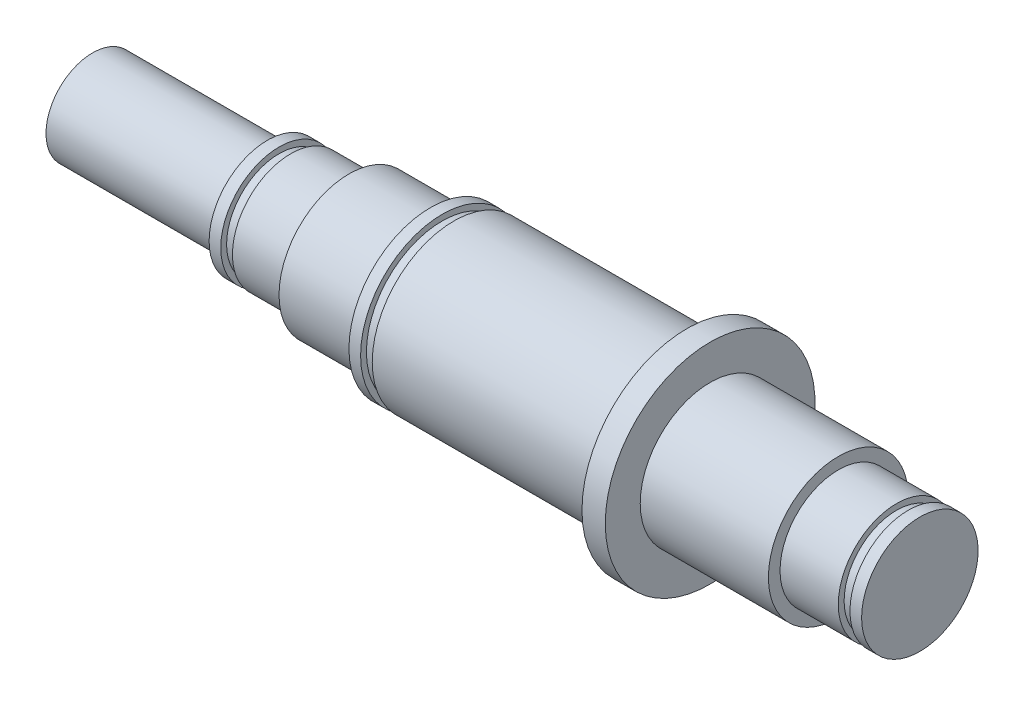
from build123d import *


with BuildPart() as part:
    # 草图1 → 旋转1 (revolve)
    with BuildSketch(Plane.XY, mode=Mode.PRIVATE) as revolve_1_sk:
        Polygon((0, 0), (0, 4), (15, 4), (15, 5), (16, 5), (16, 4.5), (17, 4.5), (17, 5), (22, 5), (22, 6), (29, 6), (29, 7), (30, 7), (30, 6.5), (31, 6.5), (31, 7), (51, 7), (51, 9), (53, 9), (53, 6), (64, 6), (64, 5), (69, 5), (69, 4.5), (70, 4.5), (70, 5), (71, 5), (71, 0), align=None)
    revolve(revolve_1_sk.sketch.rotate(Axis((0, 0, 0), (1, 0, 0)), 90), axis=Axis((0, 0, 0), (1, 0, 0)))


solid = part.part
